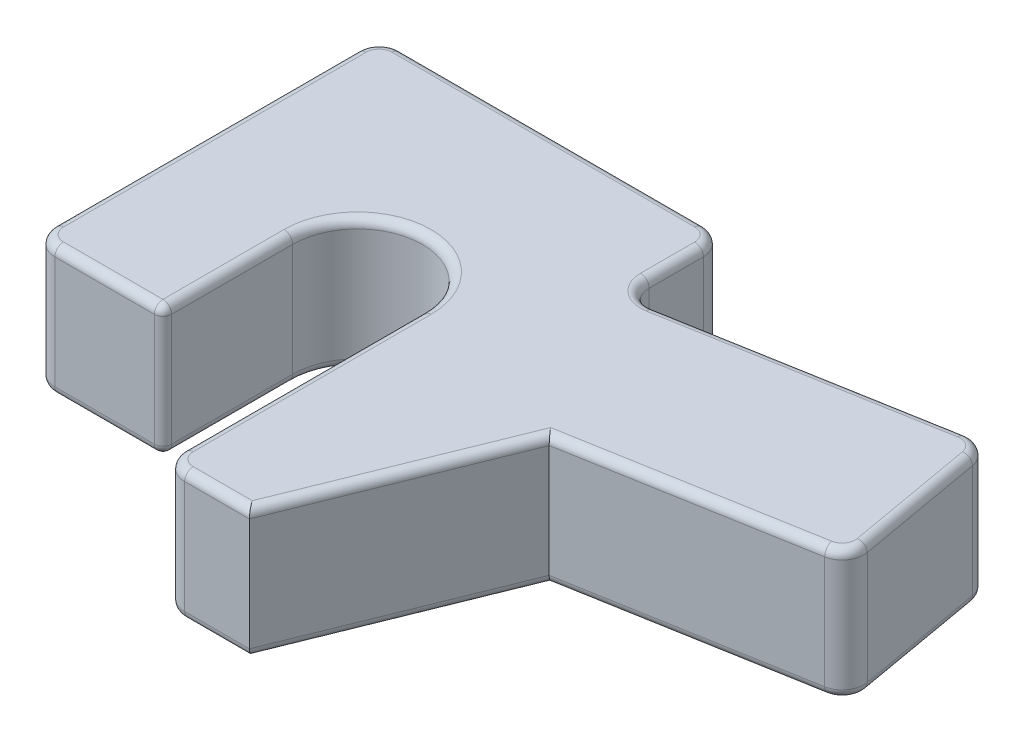
from build123d import *

# Parameters (mm, degrees)
BOSS_EXTRUDE1_DEPTH = 3
FILLET1_R           = 0.2


with BuildPart() as part:
    # Sketch1 → Boss-Extrude1 (new body)
    with BuildSketch(Plane(origin=(0, 0, 0), x_dir=(1, 0, 0), z_dir=(0, 1, 0))):
        with BuildLine():
            Line((-1.5, 0), (-1.5, -3))
            Line((-1.5, -3), (-4, -3))
            ThreePointArc((-4, -3), (-4.353553391, -2.853553391), (-4.5, -2.5))
            Line((-4.5, -2.5), (-4.5, 4.5))
            ThreePointArc((-4.5, 4.5), (-4.353553391, 4.853553391), (-4, 5))
            Line((-4, 5), (3, 5))
            ThreePointArc((3, 5), (3.353553391, 4.853553391), (3.5, 4.5))
            Line((3.5, 4.5), (3.5, 3.243874453))
            ThreePointArc((3.5, 3.243874453), (3.678606195, 2.860852231), (4.086824089, 2.751470576))
            Line((4.086824089, 2.751470576), (10.216965325, 3.832379871))
            ThreePointArc((10.216965325, 3.832379871), (10.590577632, 3.749552017), (10.79619329, 3.426800084))
            Line((10.79619329, 3.426800084), (11.317137823, 0.472376825))
            ThreePointArc((11.317137823, 0.472376825), (11.234309969, 0.098764518), (10.911558035, -0.106851141))
            Line((10.911558035, -0.106851141), (5.495115394, -1.061916118))
            Line((5.495115394, -1.061916118), (3.5, -6))
            Line((3.5, -6), (2, -6))
            ThreePointArc((2, -6), (1.646446609, -5.853553391), (1.5, -5.5))
            Line((1.5, -5.5), (1.5, 0))
            ThreePointArc((1.5, 0), (0, 1.5), (-1.5, 0))
        make_face()
    extrude(amount=BOSS_EXTRUDE1_DEPTH)

    # Fillet1
    fillet1_edges = [part.edges().sort_by_distance(p)[0] for p in [
        (3.353553391, 3, -4.853553391),
        (-0.5, 3, -5),
        (7.151894707, 0, -3.291925224),
        (10.590577632, 0, -3.749552017),
        (11.056665557, 0, -1.949588454),
        (11.234309969, 0, -0.098764518),
        (8.203336715, 0, 0.584383629),
        (-4.353553391, 3, -4.853553391),
        (4.497557697, 0, 3.530958059),
        (2.75, 0, 6),
        (1.646446609, 0, 5.853553391),
        (1.5, 0, 2.75),
        (0, 0, -1.5),
        (-1.5, 0, 1.5),
        (-2.75, 0, 3),
        (-4.353553391, 0, 2.853553391),
        (-4.5, 3, -1),
        (-4.5, 0, -1),
        (-4.353553391, 0, -4.853553391),
        (-0.5, 0, -5),
        (3.353553391, 0, -4.853553391),
        (3.5, 0, -3.871937226),
        (3.678606195, 0, -2.860852231),
        (-4.353553391, 3, 2.853553391),
        (-2.75, 3, 3),
        (-1.5, 1.5, 3),
        (-1.5, 3, 1.5),
        (0, 3, -1.5),
        (1.5, 3, 2.75),
        (1.646446609, 3, 5.853553391),
        (3.678606195, 3, -2.860852231),
        (2.75, 3, 6),
        (4.497557697, 3, 3.530958059),
        (8.203336715, 3, 0.584383629),
        (11.234309969, 3, -0.098764518),
        (11.056665557, 3, -1.949588454),
        (10.590577632, 3, -3.749552017),
        (7.151894707, 3, -3.291925224),
        (3.5, 3, -3.871937226),
    ]]
    fillet(fillet1_edges, radius=FILLET1_R)


solid = part.part
